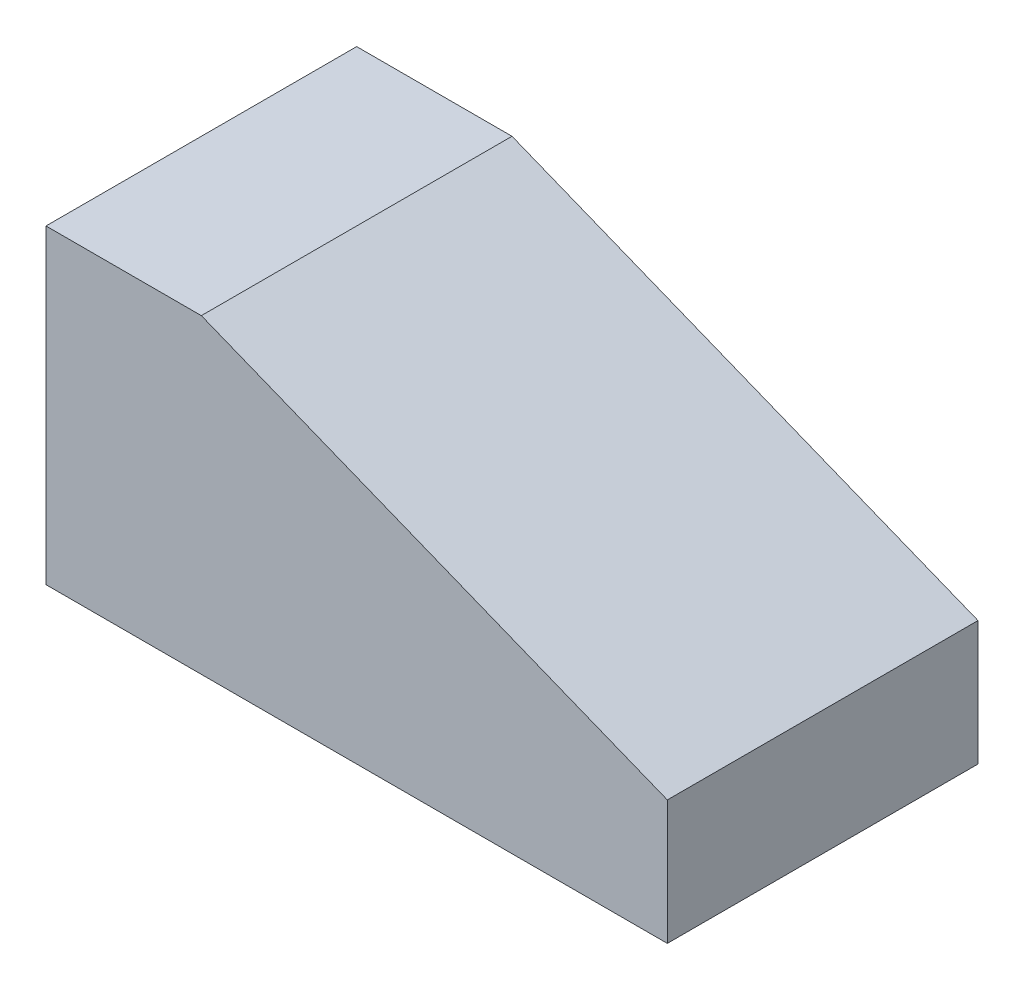
from build123d import *

# Parameters (mm, degrees)
EXTRUDE_1_DEPTH = 50


with BuildPart() as part:
    # 스케치1 → 보스-돌출1 (new body)
    with BuildSketch(Plane.XY):
        Polygon((0, 0), (100, 0), (100, 20), (25, 50), (0, 50), align=None)
    extrude(amount=EXTRUDE_1_DEPTH)


solid = part.part
